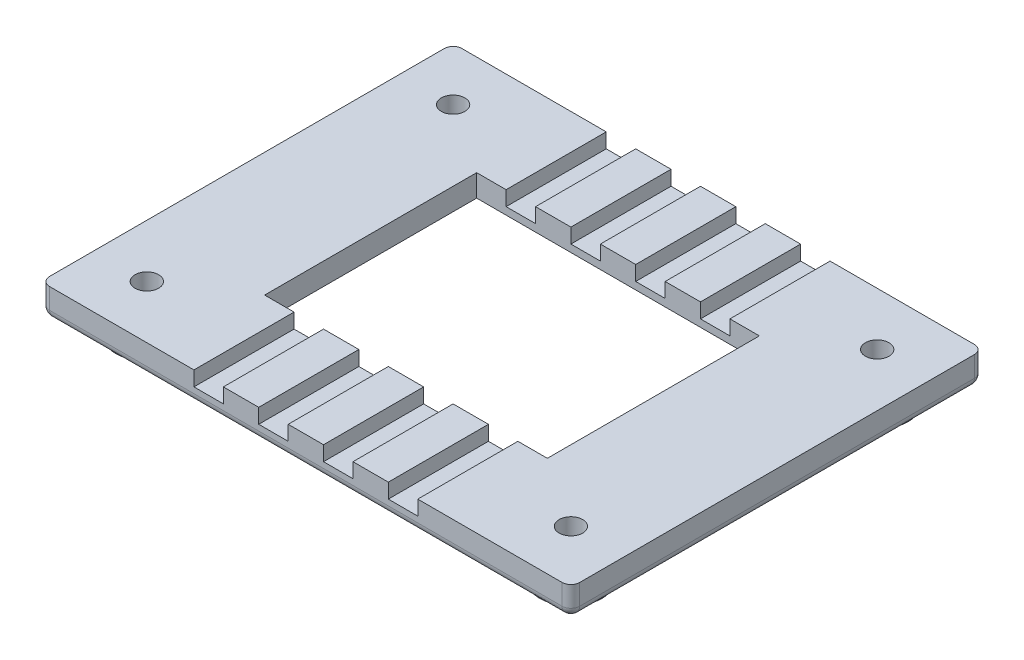
from build123d import *

# Parameters (mm, degrees)
SKETCH1_W            = 90
SKETCH1_H            = 70
BASE_PLATE_DEPTH     = 5
SKETCH7_R            = 2
SCREW_CUT_DEPTH      = 5
SKETCH13_W           = 48
SKETCH13_H           = 36
SCREEN_CUT_OUT_DEPTH = 10
SKETCH21_W           = 52
SKETCH21_H           = 40
SKETCH21_W_2         = 48
SKETCH21_H_2         = 36
SCREEN_MOUNT_DEPTH   = 1.25
SKETCH15_R           = 5.25
M3_NUT_OUTER_DEPTH   = 3
SKETCH18_R           = 2
SCREW_HOLE_DEPTH     = 3
M3_NUT_DEPTH         = 3
WATER_GROVES_REACH   = 85.367
SKETCH20_W           = 5
SKETCH20_H           = 2.5
FILLET1_R            = 1.5
FILLET2_R            = 1.5
FILLET3_R            = 1.5
FILLET4_R            = 1.5


with BuildPart() as part:
    # Sketch1 → Base Plate (new body)
    with BuildSketch(Plane(origin=(0, 0, 0), x_dir=(1, 0, 0), z_dir=(0, 1, 0))):
        Rectangle(SKETCH1_W, SKETCH1_H)
    extrude(amount=BASE_PLATE_DEPTH)

    # Sketch7 → Screw Cut (cut)
    with BuildSketch(Plane(origin=(0, 5, 0), x_dir=(1, 0, 0), z_dir=(0, 1, 0))):
        with Locations(Location((-36, 26, 0), (0, 0, 270))):
            Circle(SKETCH7_R)
        with Locations(Location((-36, -26, 0), (0, 0, 90))):
            Circle(SKETCH7_R)
        with Locations(Location((36, -26, 0), (0, 0, 270))):
            Circle(SKETCH7_R)
        with Locations(Location((36, 26, 0), (0, 0, 90))):
            Circle(SKETCH7_R)
    extrude(amount=-SCREW_CUT_DEPTH, mode=Mode.SUBTRACT)

    # Sketch13 → Screen Cut Out (cut)
    with BuildSketch(Plane(origin=(0, 5, 0), x_dir=(1, 0, 0), z_dir=(0, 1, 0))):
        Rectangle(SKETCH13_W, SKETCH13_H)
    extrude(amount=-SCREEN_CUT_OUT_DEPTH, mode=Mode.SUBTRACT)

    # Sketch21 → Screen Mount (cut)
    with BuildSketch(Plane.XZ):
        Rectangle(SKETCH21_W, SKETCH21_H)
        Rectangle(SKETCH21_W_2, SKETCH21_H_2, mode=Mode.SUBTRACT)
    extrude(amount=-SCREEN_MOUNT_DEPTH, mode=Mode.SUBTRACT)

    # Sketch15 → M3 Nut Outer (add)
    with BuildSketch(Plane(origin=(-42.5, 0, -25), x_dir=(1, 0, 0), z_dir=(0, -1, 0))):
        with Locations(Location((6.5, -1, 0), (0, 0, 90))):
            Circle(SKETCH15_R)
        with Locations(Location((6.5, 51, 0), (0, 0, 90))):
            Circle(SKETCH15_R)
        with Locations(Location((78.5, 51, 0), (0, 0, 90))):
            Circle(SKETCH15_R)
        with Locations(Location((78.5, -1, 0), (0, 0, 90))):
            Circle(SKETCH15_R)
    extrude(amount=M3_NUT_OUTER_DEPTH)

    # Sketch18 → Screw Hole (cut)
    with BuildSketch(Plane(origin=(0, 0, 0), x_dir=(1, 0, 0), z_dir=(0, 1, 0))):
        with Locations(Location((-36, 26, 0), (0, 0, 270))):
            Circle(SKETCH18_R)
        with Locations(Location((-36, -26, 0), (0, 0, 90))):
            Circle(SKETCH18_R)
        with Locations(Location((36, 26, 0), (0, 0, 90))):
            Circle(SKETCH18_R)
        with Locations(Location((36, -26, 0), (0, 0, 270))):
            Circle(SKETCH18_R)
    extrude(amount=-SCREW_HOLE_DEPTH, mode=Mode.SUBTRACT)

    # Sketch19 → M3 Nut (cut)
    with BuildSketch(Plane.XZ.offset(3)):
        Polygon((-36, -22.709103466), (-38.85, -24.354551733), (-38.85, -27.645448267), (-36, -29.290896534), (-33.15, -27.645448267), (-33.15, -24.354551733), align=None)
        Polygon((-33.15, 24.354551733), (-36, 22.709103466), (-38.85, 24.354551733), (-38.85, 27.645448267), (-36, 29.290896534), (-33.15, 27.645448267), align=None)
        Polygon((33.15, -24.354551733), (36, -22.709103466), (38.85, -24.354551733), (38.85, -27.645448267), (36, -29.290896534), (33.15, -27.645448267), align=None)
        Polygon((36, 22.709103466), (38.85, 24.354551733), (38.85, 27.645448267), (36, 29.290896534), (33.15, 27.645448267), (33.15, 24.354551733), align=None)
    extrude(amount=-M3_NUT_DEPTH, mode=Mode.SUBTRACT)

    # Water Groves: up to this face of the body (flat: up to its plane)
    water_groves_end = Plane(part.part.faces().sort_by_distance((0, 2.5, 35))[0])
    # Sketch20 → Water Groves (cut, up to the picked face)
    with BuildSketch(Plane(origin=(0, 0, -35), x_dir=(-1, 0, 0), z_dir=(0, 0, -1)), mode=Mode.PRIVATE) as water_groves_sk1:
        with Locations((-5.5, 3.75)):
            Rectangle(SKETCH20_W, SKETCH20_H)
    water_groves_tool1 = split(extrude(water_groves_sk1.sketch, amount=-WATER_GROVES_REACH, mode=Mode.PRIVATE), bisect_by=water_groves_end, keep=Keep.BOTH, mode=Mode.PRIVATE)
    # Sketch20 → Water Groves (cut, up to the picked face)
    with BuildSketch(Plane(origin=(0, 0, -35), x_dir=(-1, 0, 0), z_dir=(0, 0, -1)), mode=Mode.PRIVATE) as water_groves_sk2:
        with Locations((-16.5, 3.75)):
            Rectangle(SKETCH20_W, SKETCH20_H)
    water_groves_tool2 = split(extrude(water_groves_sk2.sketch, amount=-WATER_GROVES_REACH, mode=Mode.PRIVATE), bisect_by=water_groves_end, keep=Keep.BOTH, mode=Mode.PRIVATE)
    # Sketch20 → Water Groves (cut, up to the picked face)
    with BuildSketch(Plane(origin=(0, 0, -35), x_dir=(-1, 0, 0), z_dir=(0, 0, -1)), mode=Mode.PRIVATE) as water_groves_sk3:
        with Locations((16.5, 3.75)):
            Rectangle(SKETCH20_W, SKETCH20_H)
    water_groves_tool3 = split(extrude(water_groves_sk3.sketch, amount=-WATER_GROVES_REACH, mode=Mode.PRIVATE), bisect_by=water_groves_end, keep=Keep.BOTH, mode=Mode.PRIVATE)
    # Sketch20 → Water Groves (cut, up to the picked face)
    with BuildSketch(Plane(origin=(0, 0, -35), x_dir=(-1, 0, 0), z_dir=(0, 0, -1)), mode=Mode.PRIVATE) as water_groves_sk4:
        with Locations((5.5, 3.75)):
            Rectangle(SKETCH20_W, SKETCH20_H)
    water_groves_tool4 = split(extrude(water_groves_sk4.sketch, amount=-WATER_GROVES_REACH, mode=Mode.PRIVATE), bisect_by=water_groves_end, keep=Keep.BOTH, mode=Mode.PRIVATE)
    add(water_groves_tool1.solids().sort_by(Axis((5.5, 3.75, -35), (0, 0, 1)))[0], mode=Mode.SUBTRACT)
    add(water_groves_tool2.solids().sort_by(Axis((16.5, 3.75, -35), (0, 0, 1)))[0], mode=Mode.SUBTRACT)
    add(water_groves_tool3.solids().sort_by(Axis((-16.5, 3.75, -35), (0, 0, 1)))[0], mode=Mode.SUBTRACT)
    add(water_groves_tool4.solids().sort_by(Axis((-5.5, 3.75, -35), (0, 0, 1)))[0], mode=Mode.SUBTRACT)

    # Fillet1
    fillet1_edges = [part.edges().sort_by_distance(p)[0] for p in [
        (0, 0, -35),
    ]]
    fillet(fillet1_edges, radius=FILLET1_R)

    # Fillet2
    fillet2_edges = [part.edges().sort_by_distance(p)[0] for p in [
        (-45, 0, 0.75),
        (-45, 0.439339828, -34.560660172),
        (-45, 3.25, -35),
    ]]
    fillet(fillet2_edges, radius=FILLET2_R)

    # Fillet3
    fillet3_edges = [part.edges().sort_by_distance(p)[0] for p in [
        (0.75, 0, 35),
        (-44.560660172, 0.439339828, 35),
        (-45, 3.25, 35),
    ]]
    fillet(fillet3_edges, radius=FILLET3_R)

    # Fillet4
    fillet4_edges = [part.edges().sort_by_distance(p)[0] for p in [
        (45, 0.439339828, -34.560660172),
        (45, 0, 0),
        (45, 0.439339828, 34.560660172),
        (45, 3.25, -35),
        (45, 3.25, 35),
    ]]
    fillet(fillet4_edges, radius=FILLET4_R)


solid = part.part
